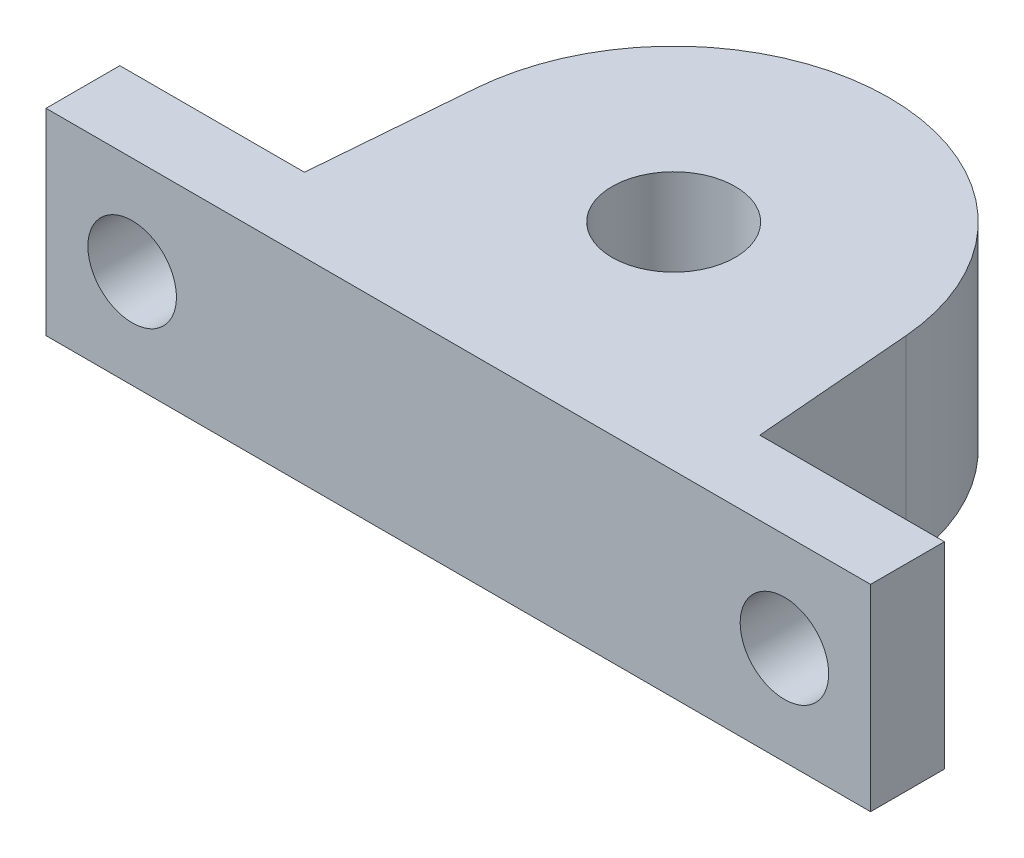
from build123d import *

# Parameters (mm, degrees)
SKETCH_1_R          = 17.5
EXTRUDE_1_DEPTH     = 16
SKETCH_2_R          = 5
CUT_EXTRUDE_1_DEPTH = 16
SKETCH_3_R          = 3.597024537
CUT_EXTRUDE_2_DEPTH = 16


with BuildPart() as part:
    # 草图1 → 凸台-拉伸1 (new body)
    with BuildSketch(Plane(origin=(0, 0, 0), x_dir=(1, 0, 0), z_dir=(0, 1, 0))):
        Circle(SKETCH_1_R)
        with BuildLine():
            Line((-33.5, -11.5), (-33.5, -17.5))
            Line((-33.5, -17.5), (-7.2e-08, -17.5))
            ThreePointArc((-7.2e-08, -17.5), (-12.869300221, -11.85879892), (-17.441650698, 1.427872863))
            Line((-17.441650698, 1.427872863), (-18.5, -11.5))
            Line((-18.5, -11.5), (-33.5, -11.5))
        make_face()
        with BuildLine():
            ThreePointArc((17.5, 0), (12.374368645, -12.374368696), (-7.2e-08, -17.5))
            Line((-7.2e-08, -17.5), (33.5, -17.5))
            Line((33.5, -17.5), (33.5, -11.5))
            Line((33.5, -11.5), (18.5, -11.5))
            Line((18.5, -11.5), (17.441650698, 1.427872863))
            ThreePointArc((17.441650698, 1.427872863), (17.48540659, 0.714532286), (17.5, 0))
        make_face()
    extrude(amount=EXTRUDE_1_DEPTH)

    # 草图2 → 切除-拉伸1 (cut)
    with BuildSketch(Plane(origin=(0, 16, 0), x_dir=(1, 0, 0), z_dir=(0, 1, 0))):
        with Locations(Location((0, 0, 0), (0, 0, 270))):
            Circle(SKETCH_2_R)
    extrude(amount=-CUT_EXTRUDE_1_DEPTH, mode=Mode.SUBTRACT)

    # 草图3 → 切除-拉伸2 (cut)
    with BuildSketch(Plane(origin=(0, 0, 11.5), x_dir=(-1, 0, 0), z_dir=(0, 0, -1))):
        with Locations((-26.5, 8)):
            Circle(SKETCH_3_R)
        with Locations((26.5, 8)):
            Circle(SKETCH_3_R)
    extrude(amount=-CUT_EXTRUDE_2_DEPTH, mode=Mode.SUBTRACT)


solid = part.part
